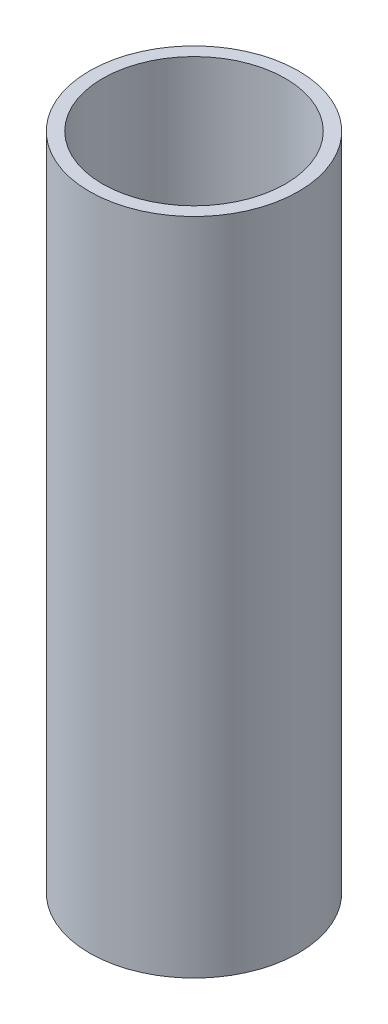
from build123d import *

# Parameters (mm, degrees)
SKETCH1_R           = 8
SKETCH1_R_2         = 7
BOSS_EXTRUDE1_DEPTH = 50.5


with BuildPart() as part:
    # Sketch1 → Boss-Extrude1 (new body)
    with BuildSketch(Plane(origin=(0, 0, 0), x_dir=(1, 0, 0), z_dir=(0, 1, 0))):
        with Locations(Location((0, 0, 0), (0, 0, 270))):
            Circle(SKETCH1_R)
        with Locations(Location((0, 0, 0), (0, 0, 270))):
            Circle(SKETCH1_R_2, mode=Mode.SUBTRACT)
    extrude(amount=BOSS_EXTRUDE1_DEPTH)


solid = part.part
